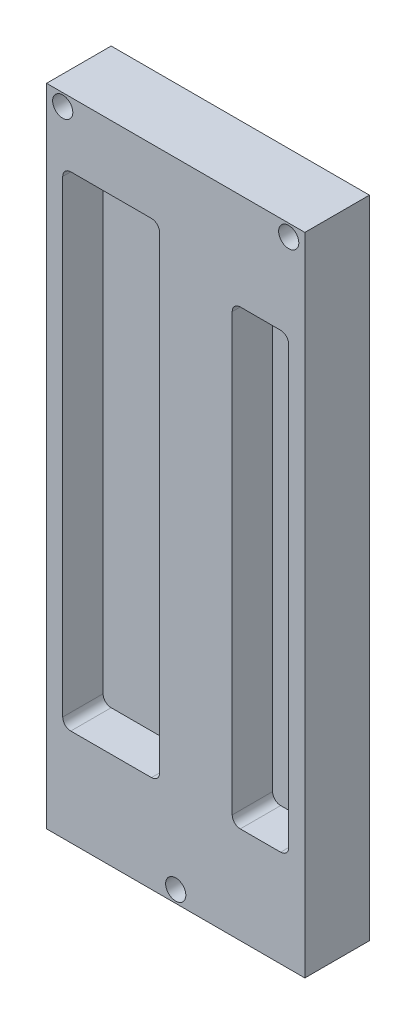
from build123d import *

# Parameters (mm, degrees)
ESQUISSE1_W             = 32
ESQUISSE1_H             = 80
ESQUISSE1_R             = 1.25
BOSS_EXTRU_2_DEPTH      = 8
ENL_V_MAT_EXTRU_1_DEPTH = 5


with BuildPart() as part:
    # Esquisse1 → Boss.-Extru.2 (new body)
    with BuildSketch(Plane.XY):
        with Locations((16, 40)):
            Rectangle(ESQUISSE1_W, ESQUISSE1_H)
        with Locations((2, 78.5)):
            Circle(ESQUISSE1_R, mode=Mode.SUBTRACT)
        with Locations((30, 78.5)):
            Circle(ESQUISSE1_R, mode=Mode.SUBTRACT)
        with Locations((16, 1.5)):
            Circle(ESQUISSE1_R, mode=Mode.SUBTRACT)
    extrude(amount=BOSS_EXTRU_2_DEPTH)

    # Esquisse2 → Enlèv. mat.-Extru.1 (cut)
    with BuildSketch(Plane.XY.offset(8)):
        with BuildLine():
            Line((24, 68), (29, 68))
            ThreePointArc((29, 68), (29.707106781, 67.707106781), (30, 67))
            Line((30, 67), (30, 13))
            ThreePointArc((30, 13), (29.707106781, 12.292893219), (29, 12))
            Line((29, 12), (24, 12))
            ThreePointArc((24, 12), (23.292893219, 12.292893219), (23, 13))
            Line((23, 13), (23, 67))
            ThreePointArc((23, 67), (23.292893219, 67.707106781), (24, 68))
        make_face()
        with BuildLine():
            Line((3, 72), (13, 72))
            ThreePointArc((13, 72), (13.707106781, 71.707106781), (14, 71))
            Line((14, 71), (14, 13))
            ThreePointArc((14, 13), (13.707106781, 12.292893219), (13, 12))
            Line((13, 12), (3, 12))
            ThreePointArc((3, 12), (2.292893219, 12.292893219), (2, 13))
            Line((2, 13), (2, 71))
            ThreePointArc((2, 71), (2.292893219, 71.707106781), (3, 72))
        make_face()
    extrude(amount=-ENL_V_MAT_EXTRU_1_DEPTH, mode=Mode.SUBTRACT)


solid = part.part
